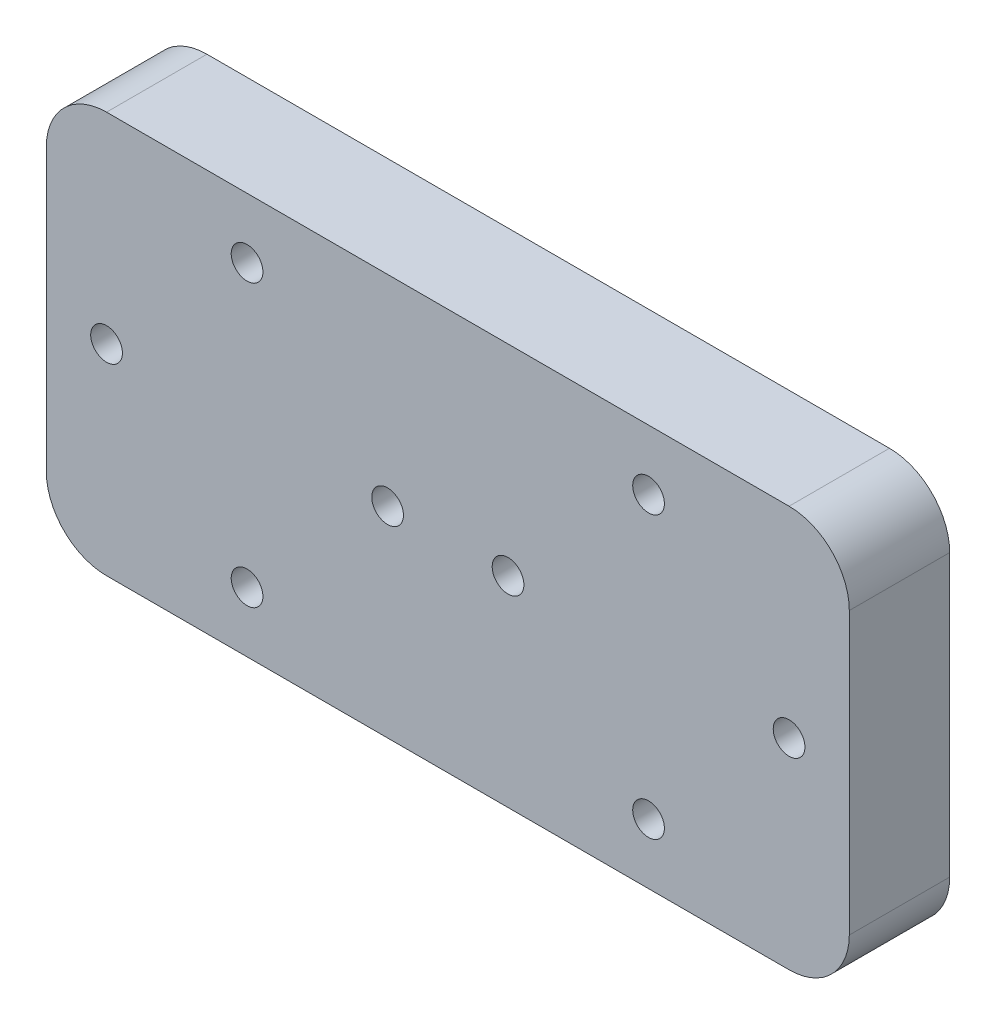
from build123d import *

# Parameters (mm, degrees)
ESQUISSE1_W             = 40
ESQUISSE1_H             = 20
BOSS_EXTRU_1_DEPTH      = 5
CONG_1_R                = 3
ESQUISSE2_R             = 0.79
ENL_V_MAT_EXTRU_1_DEPTH = 46


with BuildPart() as part:
    # Esquisse1 → Boss.-Extru.1 (new body)
    with BuildSketch(Plane.XY):
        with Locations((20, 10)):
            Rectangle(ESQUISSE1_W, ESQUISSE1_H)
    extrude(amount=BOSS_EXTRU_1_DEPTH)

    # Congé1
    cong_1_edges = [part.edges().sort_by_distance(p)[0] for p in [
        (0, 20, 2.5),
        (40, 20, 2.5),
        (40, 0, 2.5),
        (0, 0, 2.5),
    ]]
    fillet(cong_1_edges, radius=CONG_1_R)

    # Esquisse2 → Enlèv. mat.-Extru.1 (cut, through all)
    with BuildSketch(Plane.XY.offset(5)):
        with Locations((3, 10)):
            Circle(ESQUISSE2_R)
        with Locations((10, 17)):
            Circle(ESQUISSE2_R)
        with Locations((10, 3)):
            Circle(ESQUISSE2_R)
        with Locations((17, 10)):
            Circle(ESQUISSE2_R)
        with Locations(Location((23, 10, 0), (0, 0, 180))):
            Circle(ESQUISSE2_R)
        with Locations(Location((30, 3, 0), (0, 0, 180))):
            Circle(ESQUISSE2_R)
        with Locations(Location((30, 17, 0), (0, 0, 180))):
            Circle(ESQUISSE2_R)
        with Locations(Location((37, 10, 0), (0, 0, 180))):
            Circle(ESQUISSE2_R)
    extrude(amount=-ENL_V_MAT_EXTRU_1_DEPTH, mode=Mode.SUBTRACT)


solid = part.part
